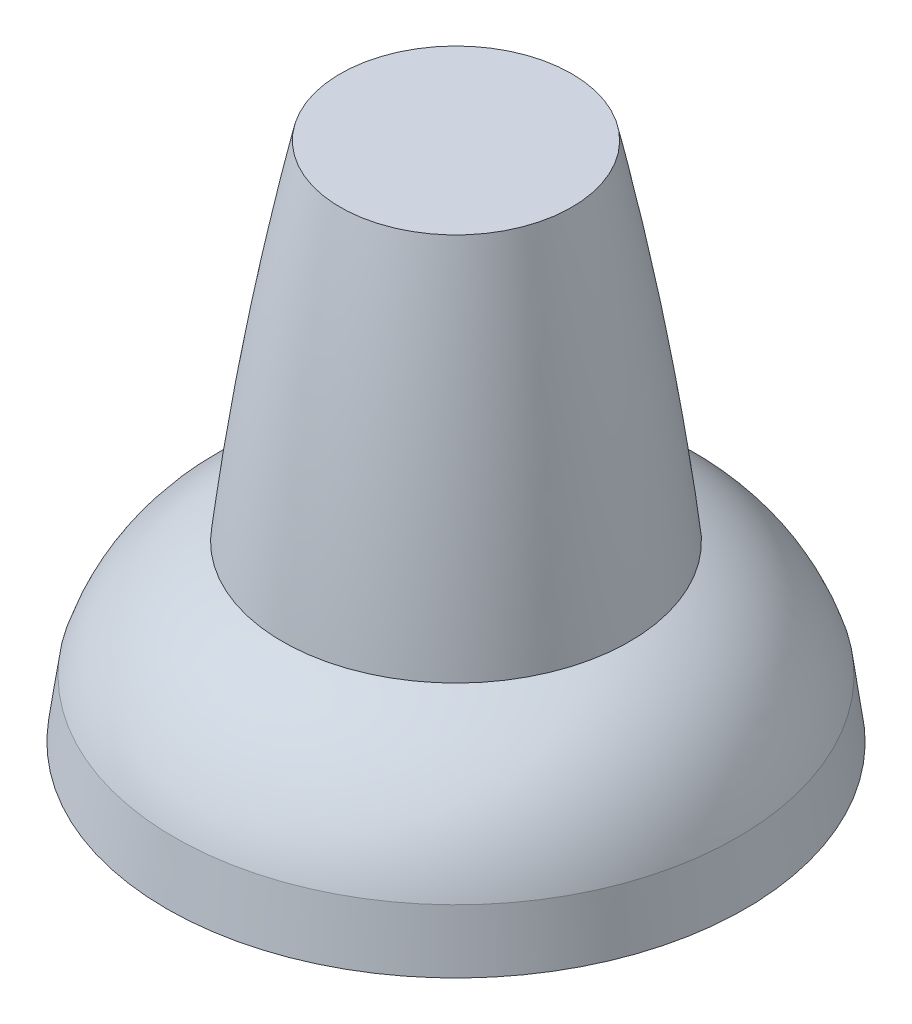
from build123d import *


with BuildPart() as part:
    # Sketch2 → Revolve1 (revolve)
    with BuildSketch(Plane.XY, mode=Mode.PRIVATE) as revolve1_sk:
        with BuildLine():
            Line((0, 0), (0, 5))
            Line((0, 5), (0, 15))
            Line((0, 15), (0, 45))
            Line((0, 45), (10, 45))
            add(Edge.make_bspline(
                [(15, 15), (13.280308285, 30.128863552), (10, 45)],
                knots=[0, 0, 0, 1, 1, 1], degree=2))
            add(Edge.make_bspline(
                [(24.32056452, 5), (22.063353764, 12.140719437), (15, 15)],
                knots=[0, 0, 0, 1, 1, 1], degree=2))
            Line((24.32056452, 5), (25, 0))
            Line((25, 0), (0, 0))
        make_face()
    revolve(revolve1_sk.sketch.rotate(Axis((0, 15, 0), (0, 1, 0)), 90), axis=Axis((0, 15, 0), (0, 1, 0)))


solid = part.part
